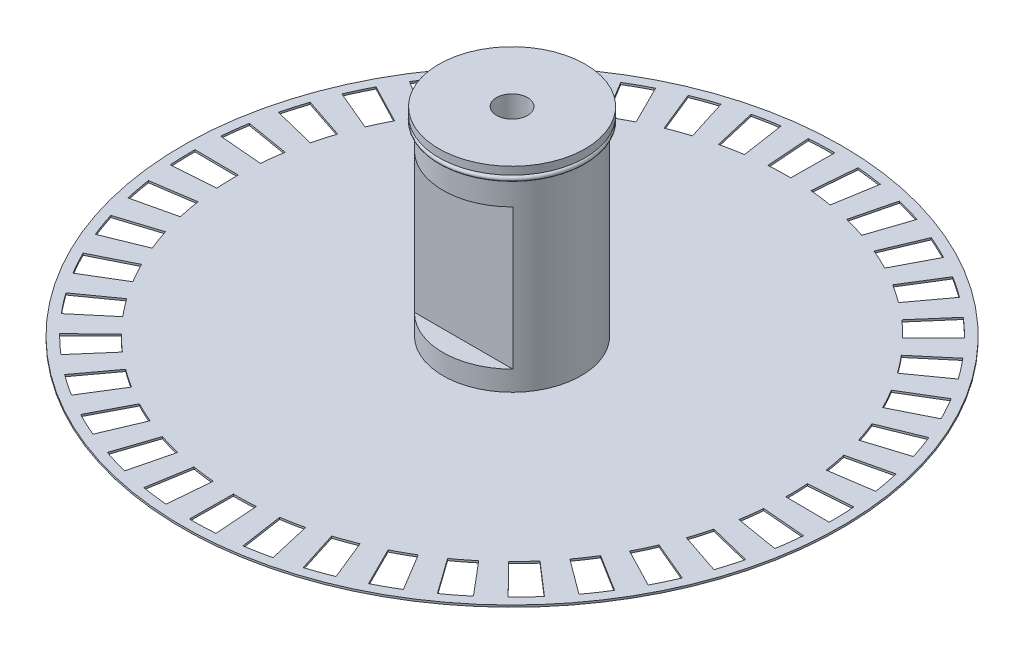
from build123d import *

# Parameters (mm, degrees)
ENL_V_MAT_EXTRU_1_DEPTH = 53.349689588
ESQUISSE3_W             = 23.080087924
ESQUISSE3_H             = 14.488991568
ENL_V_MAT_EXTRU_2_DEPTH = 5


with BuildPart() as part:
    # Esquisse1 → Révolution1 (revolve)
    with BuildSketch(Plane.XY, mode=Mode.PRIVATE) as r_volution1_sk:
        with BuildLine():
            Line((-1.6, 0), (-24, 0))
            Line((-24, 0), (-24, 1.6))
            Line((-24, 1.6), (-34, 1.6))
            Line((-34, 1.6), (-34, 1.8))
            Line((-34, 1.8), (-7.125, 1.8))
            Line((-7.125, 1.8), (-7.125, 20.94))
            ThreePointArc((-7.125, 20.94), (-7.575, 21.09), (-7.125, 21.24))
            Line((-7.125, 21.24), (-7.125, 21.5))
            Line((-7.125, 21.5), (-7.5562444, 21.5))
            Line((-7.5562444, 21.5), (-7.5562444, 22.3))
            Line((-7.5562444, 22.3), (-1.6, 22.3))
            Line((-1.6, 22.3), (-1.6, 0))
        make_face()
    revolve(r_volution1_sk.sketch.rotate(Axis((0, 0, 0), (0, 1, 0)), 270), axis=Axis((0, 0, 0), (0, 1, 0)))

    # Esquisse2 → Enlèv. mat.-Extru.1 (cut, through all)
    with BuildSketch(Plane.XZ.offset(-1.6)):
        with BuildLine():
            Line((-0.248706262, 28.498914807), (-0.287975671, 32.998743461))
            ThreePointArc((-0.287975671, 32.998743461), (1.03655505, 32.983716492), (2.359415663, 32.915545837))
            Line((2.359415663, 32.915545837), (2.037677163, 28.427062314))
            ThreePointArc((2.037677163, 28.427062314), (0.895206634, 28.48593697), (-0.248706262, 28.498914807))
        make_face()
        with BuildLine():
            Line((4.212568217, 28.186952106), (4.877710567, 32.637523491))
            ThreePointArc((4.877710567, 32.637523491), (6.183583381, 32.415479274), (7.479493145, 32.14120692))
            Line((7.479493145, 32.14120692), (6.459562262, 27.758315067))
            ThreePointArc((6.459562262, 27.758315067), (5.340367466, 27.995186646), (4.212568217, 28.186952106))
        make_face()
        with BuildLine():
            Line((8.570115286, 27.180933096), (9.923291384, 31.472659375))
            ThreePointArc((9.923291384, 31.472659375), (11.178351368, 31.049065375), (12.415400684, 30.575444819))
            Line((12.415400684, 30.575444819), (10.722391499, 26.40606598))
            ThreePointArc((10.722391499, 26.40606598), (9.654030727, 26.815101915), (8.570115286, 27.180933096))
        make_face()
        with BuildLine():
            Line((12.716637674, 25.505629306), (14.724527833, 29.532833933))
            ThreePointArc((14.724527833, 29.532833933), (15.897871245, 28.918120441), (17.045599853, 28.256813792))
            Line((17.045599853, 28.256813792), (14.721199873, 24.403611911))
            ThreePointArc((14.721199873, 24.403611911), (13.729979712, 24.974740381), (12.716637674, 25.505629306))
        make_face()
        with BuildLine():
            Line((16.550034238, 23.202292273), (19.163197538, 26.865812106))
            ThreePointArc((19.163197538, 26.865812106), (20.225932771, 26.075115408), (21.256079782, 25.24240623))
            Line((21.256079782, 25.24240623), (18.357523448, 21.800259926))
            ThreePointArc((18.357523448, 21.800259926), (17.467851029, 22.519417853), (16.550034238, 23.202292273))
        make_face()
        with BuildLine():
            Line((19.975914033, 20.327637801), (23.130005722, 23.537264822))
            ThreePointArc((23.130005722, 23.537264822), (24.055964705, 22.590054496), (24.943164483, 21.606446853))
            Line((24.943164483, 21.606446853), (21.541823871, 18.660113191))
            ThreePointArc((21.541823871, 18.660113191), (20.775605882, 19.509592519), (19.975914033, 20.327637801))
        make_face()
        with BuildLine():
            Line((22.909920528, 16.952449422), (26.5272764, 19.629151963))
            ThreePointArc((26.5272764, 19.629151963), (27.293658951, 18.548751469), (28.016065692, 17.438465046))
            Line((28.016065692, 17.438465046), (24.195693097, 15.06049254))
            ThreePointArc((24.195693097, 15.06049254), (23.571796367, 16.019376269), (22.909920528, 16.952449422))
        make_face()
        with BuildLine():
            Line((25.279808746, 13.159835477), (29.271357495, 15.237704237))
            ThreePointArc((29.271357495, 15.237704237), (29.859292731, 14.050716622), (30.399118384, 12.841090355))
            Line((30.399118384, 12.841090355), (26.253784059, 11.090032579))
            ThreePointArc((26.253784059, 11.090032579), (25.787570995, 12.13470981), (25.279808746, 13.159835477))
        make_face()
        with BuildLine():
            Line((27.027224173, 9.043182708), (31.294680622, 10.471053661))
            ThreePointArc((31.294680622, 10.471053661), (31.689691627, 9.206706499), (32.033643892, 7.927525402))
            Line((32.033643892, 7.927525402), (27.665419725, 6.846499211))
            ThreePointArc((27.665419725, 6.846499211), (27.368370042, 7.951246522), (27.027224173, 9.043182708))
        make_face()
        with BuildLine():
            Line((28.109139644, 4.703856767), (32.547424851, 5.446570993))
            ThreePointArc((32.547424851, 5.446570993), (32.739785143, 4.135996708), (32.879394774, 2.818758464))
            Line((32.879394774, 2.818758464), (28.395840941, 2.434382309))
            ThreePointArc((28.395840941, 2.434382309), (28.275268987, 3.571997157), (28.109139644, 4.703856767))
        make_face()
        with BuildLine():
            Line((28.498914807, 0.248706262), (32.998743461, 0.287975671))
            ThreePointArc((32.998743461, 0.287975671), (32.983716492, -1.03655505), (32.915545837, -2.359415663))
            Line((32.915545837, -2.359415663), (28.427062314, -2.037677163))
            ThreePointArc((28.427062314, -2.037677163), (28.48593697, -0.895206634), (28.498914807, 0.248706262))
        make_face()
        with BuildLine():
            Line((28.186952106, -4.212568217), (32.637523491, -4.877710567))
            ThreePointArc((32.637523491, -4.877710567), (32.415479274, -6.183583381), (32.14120692, -7.479493145))
            Line((32.14120692, -7.479493145), (27.758315067, -6.459562262))
            ThreePointArc((27.758315067, -6.459562262), (27.995186646, -5.340367466), (28.186952106, -4.212568217))
        make_face()
        with BuildLine():
            Line((27.180933096, -8.570115286), (31.472659375, -9.923291384))
            ThreePointArc((31.472659375, -9.923291384), (31.049065375, -11.178351368), (30.575444819, -12.415400684))
            Line((30.575444819, -12.415400684), (26.40606598, -10.722391499))
            ThreePointArc((26.40606598, -10.722391499), (26.815101915, -9.654030727), (27.180933096, -8.570115286))
        make_face()
        with BuildLine():
            Line((25.505629306, -12.716637674), (29.532833933, -14.724527833))
            ThreePointArc((29.532833933, -14.724527833), (28.918120441, -15.897871245), (28.256813792, -17.045599853))
            Line((28.256813792, -17.045599853), (24.403611911, -14.721199873))
            ThreePointArc((24.403611911, -14.721199873), (24.974740381, -13.729979712), (25.505629306, -12.716637674))
        make_face()
        with BuildLine():
            Line((23.202292273, -16.550034238), (26.865812106, -19.163197538))
            ThreePointArc((26.865812106, -19.163197538), (26.075115408, -20.225932771), (25.24240623, -21.256079782))
            Line((25.24240623, -21.256079782), (21.800259926, -18.357523448))
            ThreePointArc((21.800259926, -18.357523448), (22.519417853, -17.467851029), (23.202292273, -16.550034238))
        make_face()
        with BuildLine():
            Line((20.327637801, -19.975914033), (23.537264822, -23.130005722))
            ThreePointArc((23.537264822, -23.130005722), (22.590054496, -24.055964705), (21.606446853, -24.943164483))
            Line((21.606446853, -24.943164483), (18.660113191, -21.541823871))
            ThreePointArc((18.660113191, -21.541823871), (19.509592519, -20.775605882), (20.327637801, -19.975914033))
        make_face()
        with BuildLine():
            Line((16.952449422, -22.909920528), (19.629151963, -26.5272764))
            ThreePointArc((19.629151963, -26.5272764), (18.548751469, -27.293658951), (17.438465046, -28.016065692))
            Line((17.438465046, -28.016065692), (15.06049254, -24.195693097))
            ThreePointArc((15.06049254, -24.195693097), (16.019376269, -23.571796367), (16.952449422, -22.909920528))
        make_face()
        with BuildLine():
            Line((13.159835477, -25.279808746), (15.237704237, -29.271357495))
            ThreePointArc((15.237704237, -29.271357495), (14.050716622, -29.859292731), (12.841090355, -30.399118384))
            Line((12.841090355, -30.399118384), (11.090032579, -26.253784059))
            ThreePointArc((11.090032579, -26.253784059), (12.13470981, -25.787570995), (13.159835477, -25.279808746))
        make_face()
        with BuildLine():
            Line((9.043182708, -27.027224173), (10.471053661, -31.294680622))
            ThreePointArc((10.471053661, -31.294680622), (9.206706499, -31.689691627), (7.927525402, -32.033643892))
            Line((7.927525402, -32.033643892), (6.846499211, -27.665419725))
            ThreePointArc((6.846499211, -27.665419725), (7.951246522, -27.368370042), (9.043182708, -27.027224173))
        make_face()
        with BuildLine():
            Line((4.703856767, -28.109139644), (5.446570993, -32.547424851))
            ThreePointArc((5.446570993, -32.547424851), (4.135996708, -32.739785143), (2.818758464, -32.879394774))
            Line((2.818758464, -32.879394774), (2.434382309, -28.395840941))
            ThreePointArc((2.434382309, -28.395840941), (3.571997157, -28.275268987), (4.703856767, -28.109139644))
        make_face()
        with BuildLine():
            Line((0.248706262, -28.498914807), (0.287975671, -32.998743461))
            ThreePointArc((0.287975671, -32.998743461), (-1.03655505, -32.983716492), (-2.359415663, -32.915545837))
            Line((-2.359415663, -32.915545837), (-2.037677163, -28.427062314))
            ThreePointArc((-2.037677163, -28.427062314), (-0.895206634, -28.48593697), (0.248706262, -28.498914807))
        make_face()
        with BuildLine():
            Line((-4.212568217, -28.186952106), (-4.877710567, -32.637523491))
            ThreePointArc((-4.877710567, -32.637523491), (-6.183583381, -32.415479274), (-7.479493145, -32.14120692))
            Line((-7.479493145, -32.14120692), (-6.459562262, -27.758315067))
            ThreePointArc((-6.459562262, -27.758315067), (-5.340367466, -27.995186646), (-4.212568217, -28.186952106))
        make_face()
        with BuildLine():
            Line((-8.570115286, -27.180933096), (-9.923291384, -31.472659375))
            ThreePointArc((-9.923291384, -31.472659375), (-11.178351368, -31.049065375), (-12.415400684, -30.575444819))
            Line((-12.415400684, -30.575444819), (-10.722391499, -26.40606598))
            ThreePointArc((-10.722391499, -26.40606598), (-9.654030727, -26.815101915), (-8.570115286, -27.180933096))
        make_face()
        with BuildLine():
            Line((-12.716637674, -25.505629306), (-14.724527833, -29.532833933))
            ThreePointArc((-14.724527833, -29.532833933), (-15.897871245, -28.918120441), (-17.045599853, -28.256813792))
            Line((-17.045599853, -28.256813792), (-14.721199873, -24.403611911))
            ThreePointArc((-14.721199873, -24.403611911), (-13.729979712, -24.974740381), (-12.716637674, -25.505629306))
        make_face()
        with BuildLine():
            Line((-16.550034238, -23.202292273), (-19.163197538, -26.865812106))
            ThreePointArc((-19.163197538, -26.865812106), (-20.225932771, -26.075115408), (-21.256079782, -25.24240623))
            Line((-21.256079782, -25.24240623), (-18.357523448, -21.800259926))
            ThreePointArc((-18.357523448, -21.800259926), (-17.467851029, -22.519417853), (-16.550034238, -23.202292273))
        make_face()
        with BuildLine():
            Line((-19.975914033, -20.327637801), (-23.130005722, -23.537264822))
            ThreePointArc((-23.130005722, -23.537264822), (-24.055964705, -22.590054496), (-24.943164483, -21.606446853))
            Line((-24.943164483, -21.606446853), (-21.541823871, -18.660113191))
            ThreePointArc((-21.541823871, -18.660113191), (-20.775605882, -19.509592519), (-19.975914033, -20.327637801))
        make_face()
        with BuildLine():
            Line((-22.909920528, -16.952449422), (-26.5272764, -19.629151963))
            ThreePointArc((-26.5272764, -19.629151963), (-27.293658951, -18.548751469), (-28.016065692, -17.438465046))
            Line((-28.016065692, -17.438465046), (-24.195693097, -15.06049254))
            ThreePointArc((-24.195693097, -15.06049254), (-23.571796367, -16.019376269), (-22.909920528, -16.952449422))
        make_face()
        with BuildLine():
            Line((-25.279808746, -13.159835477), (-29.271357495, -15.237704237))
            ThreePointArc((-29.271357495, -15.237704237), (-29.859292731, -14.050716622), (-30.399118384, -12.841090355))
            Line((-30.399118384, -12.841090355), (-26.253784059, -11.090032579))
            ThreePointArc((-26.253784059, -11.090032579), (-25.787570995, -12.13470981), (-25.279808746, -13.159835477))
        make_face()
        with BuildLine():
            Line((-27.027224173, -9.043182708), (-31.294680622, -10.471053661))
            ThreePointArc((-31.294680622, -10.471053661), (-31.689691627, -9.206706499), (-32.033643892, -7.927525402))
            Line((-32.033643892, -7.927525402), (-27.665419725, -6.846499211))
            ThreePointArc((-27.665419725, -6.846499211), (-27.368370042, -7.951246522), (-27.027224173, -9.043182708))
        make_face()
        with BuildLine():
            Line((-28.109139644, -4.703856767), (-32.547424851, -5.446570993))
            ThreePointArc((-32.547424851, -5.446570993), (-32.739785143, -4.135996708), (-32.879394774, -2.818758464))
            Line((-32.879394774, -2.818758464), (-28.395840941, -2.434382309))
            ThreePointArc((-28.395840941, -2.434382309), (-28.275268987, -3.571997157), (-28.109139644, -4.703856767))
        make_face()
        with BuildLine():
            Line((-28.498914807, -0.248706262), (-32.998743461, -0.287975671))
            ThreePointArc((-32.998743461, -0.287975671), (-32.983716492, 1.03655505), (-32.915545837, 2.359415663))
            Line((-32.915545837, 2.359415663), (-28.427062314, 2.037677163))
            ThreePointArc((-28.427062314, 2.037677163), (-28.48593697, 0.895206634), (-28.498914807, -0.248706262))
        make_face()
        with BuildLine():
            Line((-28.186952106, 4.212568217), (-32.637523491, 4.877710567))
            ThreePointArc((-32.637523491, 4.877710567), (-32.415479274, 6.183583381), (-32.14120692, 7.479493145))
            Line((-32.14120692, 7.479493145), (-27.758315067, 6.459562262))
            ThreePointArc((-27.758315067, 6.459562262), (-27.995186646, 5.340367466), (-28.186952106, 4.212568217))
        make_face()
        with BuildLine():
            Line((-27.180933096, 8.570115286), (-31.472659375, 9.923291384))
            ThreePointArc((-31.472659375, 9.923291384), (-31.049065375, 11.178351368), (-30.575444819, 12.415400684))
            Line((-30.575444819, 12.415400684), (-26.40606598, 10.722391499))
            ThreePointArc((-26.40606598, 10.722391499), (-26.815101915, 9.654030727), (-27.180933096, 8.570115286))
        make_face()
        with BuildLine():
            Line((-25.505629306, 12.716637674), (-29.532833933, 14.724527833))
            ThreePointArc((-29.532833933, 14.724527833), (-28.918120441, 15.897871245), (-28.256813792, 17.045599853))
            Line((-28.256813792, 17.045599853), (-24.403611911, 14.721199873))
            ThreePointArc((-24.403611911, 14.721199873), (-24.974740381, 13.729979712), (-25.505629306, 12.716637674))
        make_face()
        with BuildLine():
            Line((-23.202292273, 16.550034238), (-26.865812106, 19.163197538))
            ThreePointArc((-26.865812106, 19.163197538), (-26.075115408, 20.225932771), (-25.24240623, 21.256079782))
            Line((-25.24240623, 21.256079782), (-21.800259926, 18.357523448))
            ThreePointArc((-21.800259926, 18.357523448), (-22.519417853, 17.467851029), (-23.202292273, 16.550034238))
        make_face()
        with BuildLine():
            Line((-20.327637801, 19.975914033), (-23.537264822, 23.130005722))
            ThreePointArc((-23.537264822, 23.130005722), (-22.590054496, 24.055964705), (-21.606446853, 24.943164483))
            Line((-21.606446853, 24.943164483), (-18.660113191, 21.541823871))
            ThreePointArc((-18.660113191, 21.541823871), (-19.509592519, 20.775605882), (-20.327637801, 19.975914033))
        make_face()
        with BuildLine():
            Line((-16.952449422, 22.909920528), (-19.629151963, 26.5272764))
            ThreePointArc((-19.629151963, 26.5272764), (-18.548751469, 27.293658951), (-17.438465046, 28.016065692))
            Line((-17.438465046, 28.016065692), (-15.06049254, 24.195693097))
            ThreePointArc((-15.06049254, 24.195693097), (-16.019376269, 23.571796367), (-16.952449422, 22.909920528))
        make_face()
        with BuildLine():
            Line((-13.159835477, 25.279808746), (-15.237704237, 29.271357495))
            ThreePointArc((-15.237704237, 29.271357495), (-14.050716622, 29.859292731), (-12.841090355, 30.399118384))
            Line((-12.841090355, 30.399118384), (-11.090032579, 26.253784059))
            ThreePointArc((-11.090032579, 26.253784059), (-12.13470981, 25.787570995), (-13.159835477, 25.279808746))
        make_face()
        with BuildLine():
            Line((-9.043182708, 27.027224173), (-10.471053661, 31.294680622))
            ThreePointArc((-10.471053661, 31.294680622), (-9.206706499, 31.689691627), (-7.927525402, 32.033643892))
            Line((-7.927525402, 32.033643892), (-6.846499211, 27.665419725))
            ThreePointArc((-6.846499211, 27.665419725), (-7.951246522, 27.368370042), (-9.043182708, 27.027224173))
        make_face()
        with BuildLine():
            Line((-4.703856767, 28.109139644), (-5.446570993, 32.547424851))
            ThreePointArc((-5.446570993, 32.547424851), (-4.135996708, 32.739785143), (-2.818758464, 32.879394774))
            Line((-2.818758464, 32.879394774), (-2.434382309, 28.395840941))
            ThreePointArc((-2.434382309, 28.395840941), (-3.571997157, 28.275268987), (-4.703856767, 28.109139644))
        make_face()
    extrude(amount=-ENL_V_MAT_EXTRU_1_DEPTH, mode=Mode.SUBTRACT)

    # Esquisse3 → Enlèv. mat.-Extru.2 (cut)
    with BuildSketch(Plane.XY.offset(10)):
        with Locations((-0.016719137, 11.1178377)):
            Rectangle(ESQUISSE3_W, ESQUISSE3_H)
    extrude(amount=-ENL_V_MAT_EXTRU_2_DEPTH, mode=Mode.SUBTRACT)


solid = part.part
